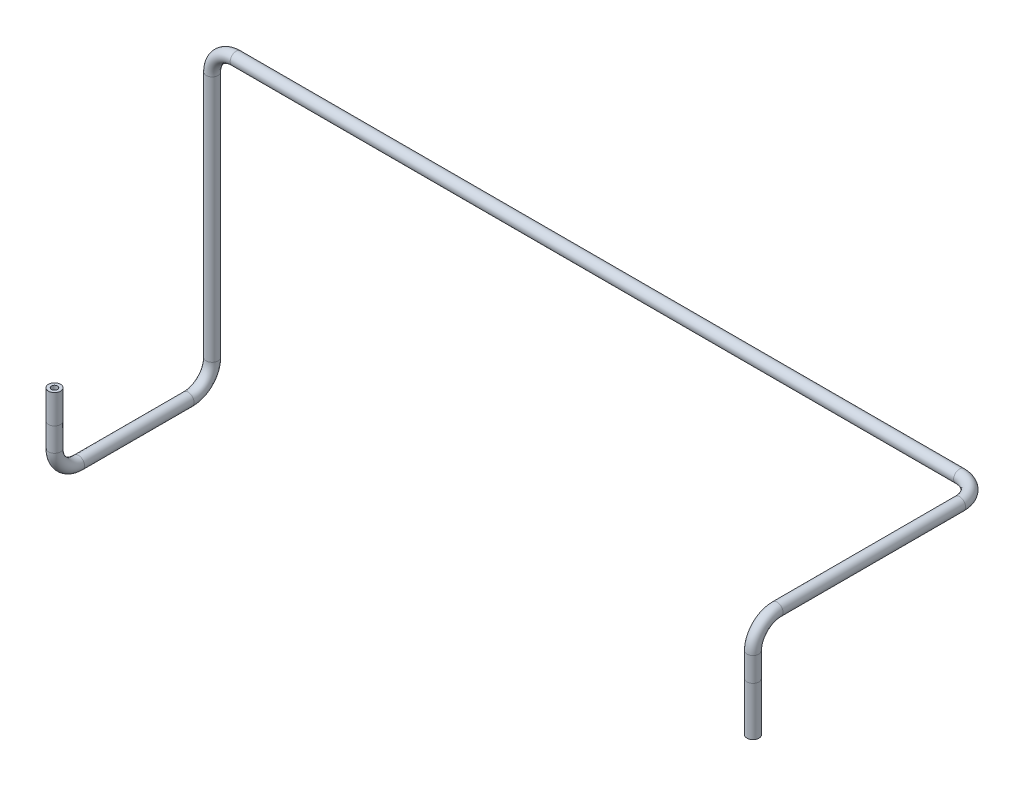
from build123d import *

# Parameters (mm, degrees)
SKETCH1_R   = 1.5875
SKETCH1_R_2 = 0.8001


with BuildPart() as part:
    # Sweep1: sweep along a curve in space
    with BuildLine() as sweep1_path:
        Line((-197.939741051, -11.615, 57.114862899), (-197.939741051, -3.995, 57.114862899))
        Line((-197.939741051, -11.615, 57.114862899), (-197.939741051, -17.878246192, 57.114862899))
        ThreePointArc((-197.939741051, -17.878246192, 57.114862899), (-197.939741051, -22.368374252, 55.25499096), (-197.939741051, -24.228246192, 50.764862899))
        Line((-197.939741051, -24.228246192, 50.764862899), (-197.939741051, -24.228246192, 21.844999987))
        ThreePointArc((-197.939741051, -24.228246192, 21.844999987), (-197.939741051, -22.368374252, 17.354871927), (-197.939741051, -17.878246192, 15.494999987))
        Line((-197.939741051, -17.878246192, 15.494999987), (-197.939741051, 47.385689331, 15.494999987))
        ThreePointArc((-197.939741051, 47.385689331, 15.494999987), (-196.079869112, 51.875817391, 15.494999987), (-191.589741051, 53.735689331, 15.494999987))
        Line((-191.589741051, 53.735689331, 15.494999987), (-0.569741051, 53.735689331, 15.494999987))
        ThreePointArc((5.780258949, 53.735689331, 21.844999987), (3.920387009, 53.735689331, 17.354871927), (-0.569741051, 53.735689331, 15.494999987))
        Line((5.780258949, 53.735689331, 70.055162899), (5.780258949, 53.735689331, 21.844999987))
        ThreePointArc((5.780258949, 47.385689331, 76.405162899), (5.780258949, 51.875817391, 74.54529096), (5.780258949, 53.735689331, 70.055162899))
        Line((5.780258949, 41.021, 76.405162899), (5.780258949, 47.385689331, 76.405162899))
        Line((5.780258949, 41.021, 76.405162899), (5.780258949, 28.15482701, 76.405162899))
    # Sketch1 → Sweep1 (sweep)
    with BuildSketch(Plane(origin=(-197.939741051, -3.995, 57.114862899), x_dir=(1, 0, 0), z_dir=(0, 1, 0))):
        Circle(SKETCH1_R)
        Circle(SKETCH1_R_2, mode=Mode.SUBTRACT)
    sweep(path=sweep1_path.line)


solid = part.part
